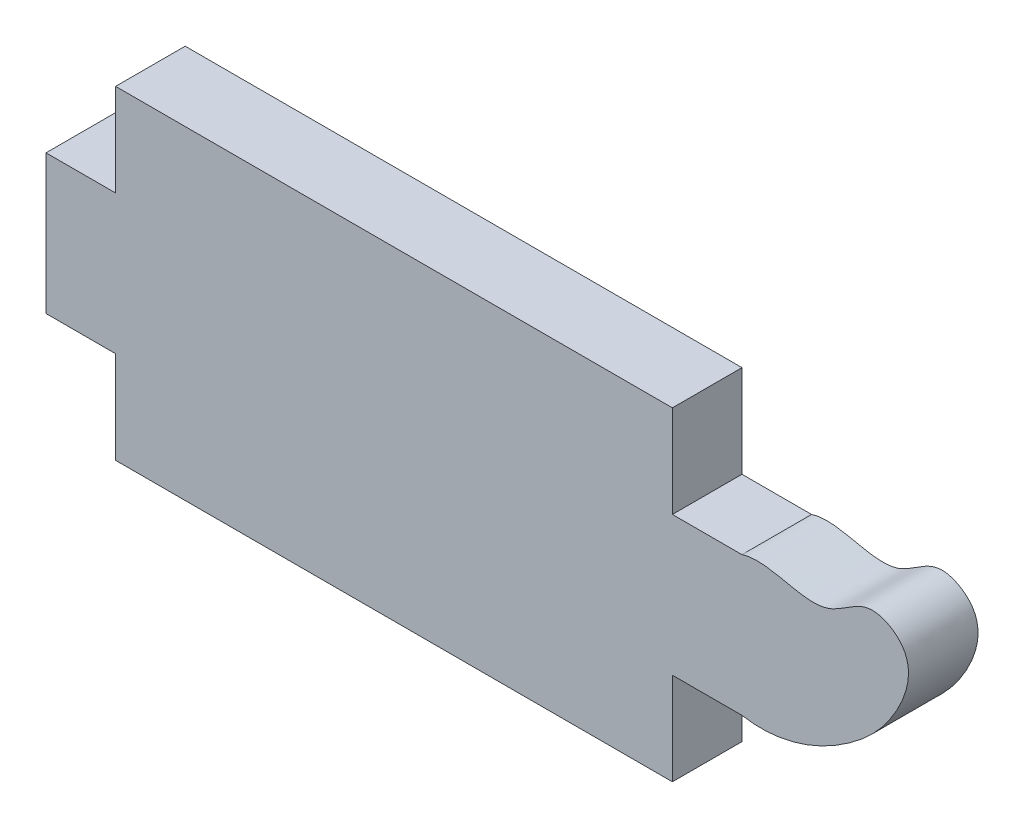
from build123d import *

# Parameters (mm, degrees)
BOSS_EXTRUDE1_DEPTH = 3.175


with BuildPart() as part:
    # Sketch1 → Boss-Extrude1 (new body)
    with BuildSketch(Plane.XY):
        with BuildLine():
            Line((0, 33.23762074), (-25.4, 33.23762074))
            Line((-25.4, 33.23762074), (-25.4, 37.450381497))
            Line((-25.4, 37.450381497), (-28.575, 37.450381497))
            Line((-28.575, 37.450381497), (-28.575, 43.800381497))
            Line((-28.575, 43.800381497), (-25.4, 43.800381497))
            Line((-25.4, 43.800381497), (-25.4, 48.013142253))
            Line((-25.4, 48.013142253), (0, 48.013142253))
            Line((0, 48.013142253), (0, 43.800381497))
            Line((0, 43.800381497), (3.175, 43.800381497))
            add(Edge.make_bspline(
                [(3.175, 37.450381497), (5.022063889, 37.118455803), (7.751511416, 38.26025543), (10.232762973, 40.756833062), (11.320046176, 43.626059772), (8.823727593, 45.046390193), (6.727894231, 42.678395659), (4.43155314, 44.217938487), (3.175, 43.800381497)],
                knots=[0, 0, 0, 0, 0.293580814, 0.427451978, 0.586796469, 0.673694467, 0.788354379, 1, 1, 1, 1], degree=3))
            Line((3.175, 37.450381497), (0, 37.450381497))
            Line((0, 37.450381497), (0, 33.23762074))
        make_face()
    extrude(amount=-BOSS_EXTRUDE1_DEPTH)


solid = part.part
